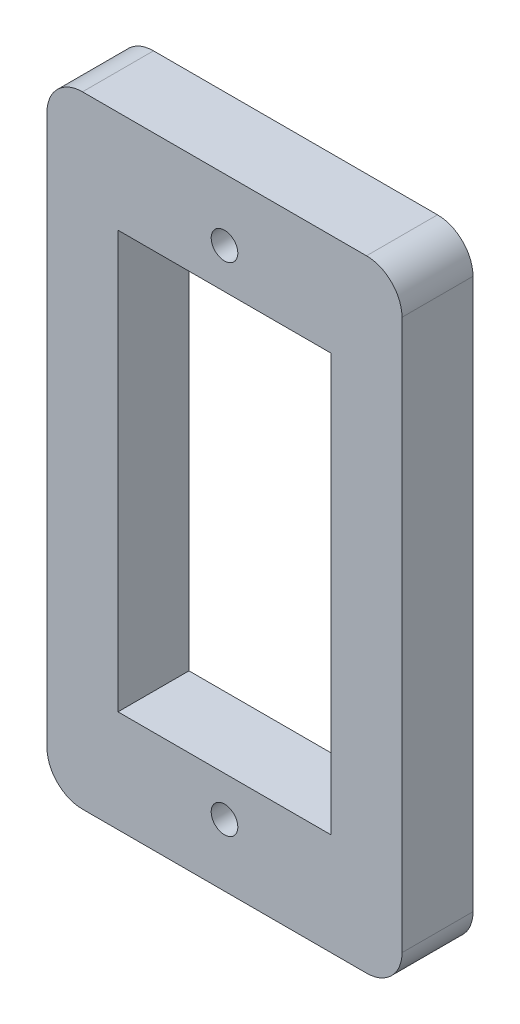
from build123d import *

# Parameters (mm, degrees)
SKIZZE1_W                       = 20
SKIZZE1_H                       = 35
SKIZZE1_W_2                     = 12
SKIZZE1_H_2                     = 23.5
GRUNDPLATTE_DEPTH               = 4
SKIZZE2_R                       = 0.75
SCHNITT_LINEAR_AUSTRAGEN1_DEPTH = 21.548722588
VERRUNDUNG1_R                   = 2


with BuildPart() as part:
    # Skizze1 → Grundplatte (new body)
    with BuildSketch(Plane.XY):
        Rectangle(SKIZZE1_W, SKIZZE1_H)
        Rectangle(SKIZZE1_W_2, SKIZZE1_H_2, mode=Mode.SUBTRACT)
    extrude(amount=GRUNDPLATTE_DEPTH)

    # Skizze2 → Schnitt-Linear austragen1 (cut, through all)
    with BuildSketch(Plane.XY.offset(4)):
        with Locations((0, 14)):
            Circle(SKIZZE2_R)
        with Locations(Location((0, -14, 0), (0, 0, 180))):
            Circle(SKIZZE2_R)
    extrude(amount=-SCHNITT_LINEAR_AUSTRAGEN1_DEPTH, mode=Mode.SUBTRACT)

    # Verrundung1
    verrundung1_edges = [part.edges().sort_by_distance(p)[0] for p in [
        (10, -17.5, 2),
        (-10, -17.5, 2),
        (-10, 17.5, 2),
        (10, 17.5, 2),
    ]]
    fillet(verrundung1_edges, radius=VERRUNDUNG1_R)


solid = part.part
